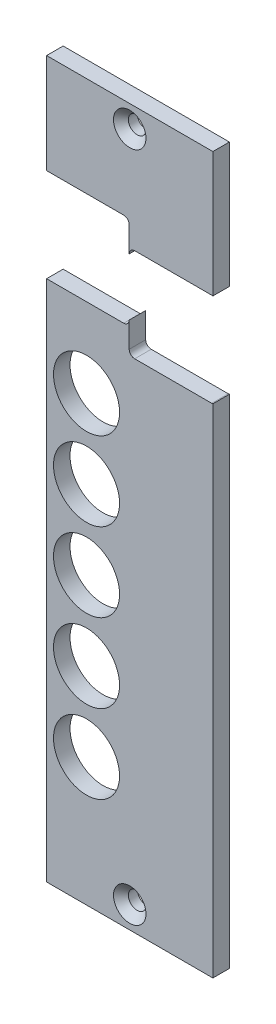
from build123d import *

# Parameters (mm, degrees)
MODEL_R                           = 1.6
AUFSATZ_LINEAR_AUSTRAGEN1_DEPTH   = 3
MODEL_R_2                         = 6
AUFSATZ_LINEAR_AUSTRAGEN1_2_DEPTH = 3
FASE1_SIZE                        = 1.35
FASE2_SIZE                        = 1.35


with BuildPart() as part:
    # Model → Aufsatz-Linear austragen1 (new body)
    with BuildSketch(Plane.XY):
        with BuildLine():
            Line((30.2, 107.279795897), (30.2, 130))
            Line((30.2, 130), (0, 130))
            Line((0, 130), (0, 111.9))
            Line((0, 111.9), (14, 111.9))
            ThreePointArc((14, 111.9), (14.707106781, 111.607106781), (15, 110.9))
            Line((15, 110.9), (15, 106.3))
            ThreePointArc((15, 106.3), (15.292893219, 107.007106781), (16, 107.3))
            Line((16, 107.3), (30, 107.3))
            ThreePointArc((30, 107.3), (30.100508962, 107.294936153), (30.2, 107.279795897))
        make_face()
        with Locations((15.1, 126)):
            Circle(MODEL_R, mode=Mode.SUBTRACT)
    extrude(amount=-AUFSATZ_LINEAR_AUSTRAGEN1_DEPTH)

    # Fase2
    fase2_edges = [part.edges().sort_by_distance(p)[0] for p in [
        (13.5, 126, 0),
    ]]
    chamfer(fase2_edges, length=FASE2_SIZE)


with BuildPart() as body_2:
    # Model → Aufsatz-Linear austragen1 2 (new body)
    with BuildSketch(Plane.XY):
        with BuildLine():
            Line((30.2, 0), (30.2, 90.320204103))
            ThreePointArc((30.2, 90.320204103), (30.100508962, 90.305063847), (30, 90.3))
            Line((30, 90.3), (16, 90.3))
            ThreePointArc((16, 90.3), (15.292893219, 90.592893219), (15, 91.3))
            Line((15, 91.3), (15, 95.9))
            ThreePointArc((15, 95.9), (14.707106781, 95.192893219), (14, 94.9))
            Line((14, 94.9), (0, 94.9))
            Line((0, 94.9), (0, 0))
            Line((0, 0), (30.2, 0))
        make_face()
        with Locations((7.25, 23.29)):
            Circle(MODEL_R_2, mode=Mode.SUBTRACT)
        with Locations((7.25, 37.59)):
            Circle(MODEL_R_2, mode=Mode.SUBTRACT)
        with Locations((7.25, 51.89)):
            Circle(MODEL_R_2, mode=Mode.SUBTRACT)
        with Locations((7.25, 66.19)):
            Circle(MODEL_R_2, mode=Mode.SUBTRACT)
        with Locations((7.25, 80.49)):
            Circle(MODEL_R_2, mode=Mode.SUBTRACT)
        with Locations((15.1, 4)):
            Circle(MODEL_R, mode=Mode.SUBTRACT)
    extrude(amount=-AUFSATZ_LINEAR_AUSTRAGEN1_2_DEPTH)

    # Fase1
    fase1_edges = [body_2.edges().sort_by_distance(p)[0] for p in [
        (13.5, 4, 0),
    ]]
    chamfer(fase1_edges, length=FASE1_SIZE)


solid = Compound([part.part, body_2.part])
